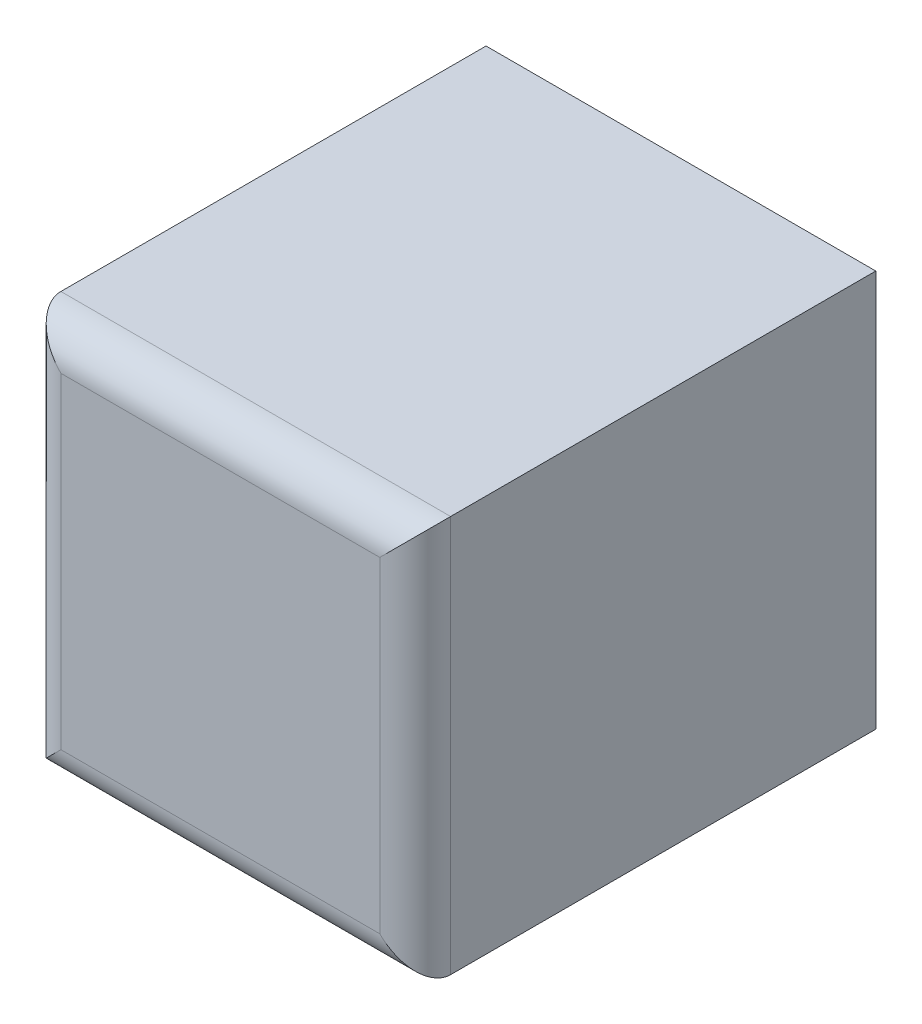
from build123d import *

# Parameters (mm, degrees)
SKETCH_1_W      = 55
SKETCH_1_H      = 56
EXTRUDE_1_DEPTH = 65
FILLET_1_R      = 5


with BuildPart() as part:
    # 草图1 → 凸台-拉伸1 (new body)
    with BuildSketch(Plane.XY):
        with Locations((27.5, -28)):
            Rectangle(SKETCH_1_W, SKETCH_1_H)
    extrude(amount=EXTRUDE_1_DEPTH)

    # 圆角1
    fillet_1_edges = [part.edges().sort_by_distance(p)[0] for p in [
        (55, -28, 65),
        (27.5, 0, 65),
        (0, -28, 65),
        (27.5, -56, 65),
    ]]
    fillet(fillet_1_edges, radius=FILLET_1_R)


solid = part.part
